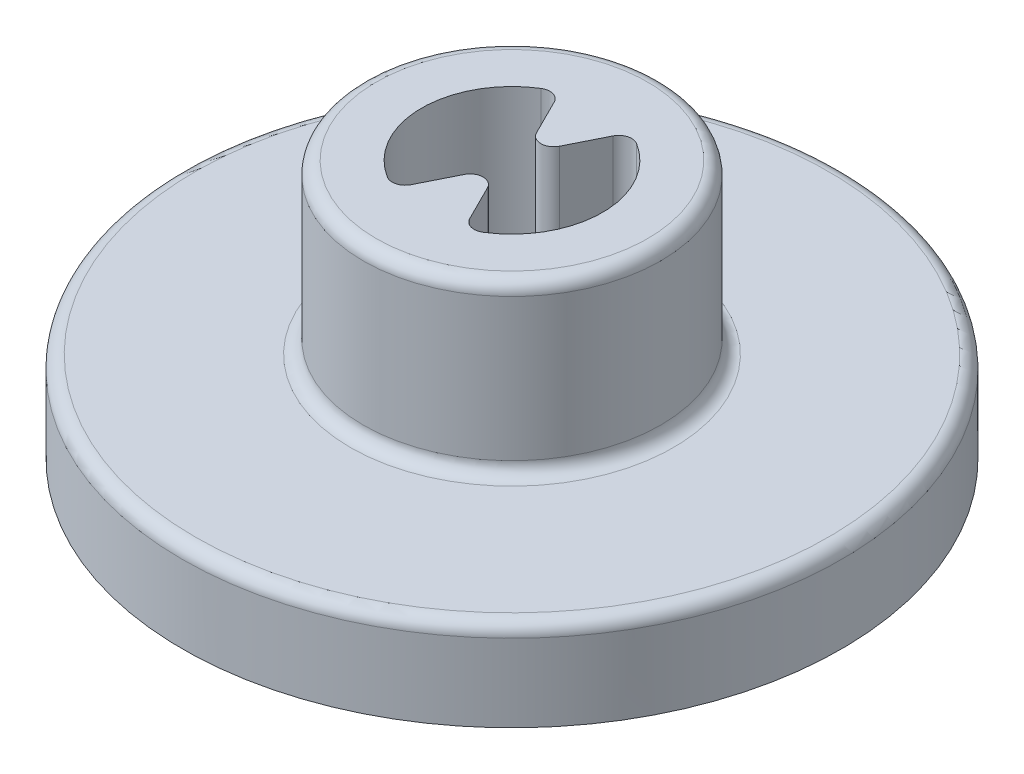
from build123d import *

# Parameters (mm, degrees)
SKETCH1_R           = 12.75
BOSS_EXTRUDE2_DEPTH = 3.5
SKETCH2_R           = 5.75
BOSS_EXTRUDE3_DEPTH = 6.5
CUT_EXTRUDE1_DEPTH  = 10
FILLET3_R           = 0.5
FILLET4_R           = 0.5


with BuildPart() as part:
    # Sketch1 → Boss-Extrude2 (new body)
    with BuildSketch(Plane(origin=(0, 0, 0), x_dir=(1, 0, 0), z_dir=(0, 1, 0))):
        with Locations(Location((0, 0, 0), (0, 0, 90))):
            Circle(SKETCH1_R)
    extrude(amount=BOSS_EXTRUDE2_DEPTH)

    # Sketch2 → Boss-Extrude3 (add)
    with BuildSketch(Plane(origin=(0, 3.5, 0), x_dir=(1, 0, 0), z_dir=(0, 1, 0))):
        with Locations(Location((0, 0, 0), (0, 0, 270))):
            Circle(SKETCH2_R)
    extrude(amount=BOSS_EXTRUDE3_DEPTH)

    # Sketch3 → Cut-Extrude1 (cut)
    with BuildSketch(Plane(origin=(0, 10, 0), x_dir=(1, 0, 0), z_dir=(0, 1, 0))):
        with BuildLine():
            Line((-0.447213595, 1.394427191), (-1.135934639, 2.771869278))
            ThreePointArc((-1.135934639, 2.771869278), (-1.447076632, 3.029390861), (-1.847006274, 2.972972894))
            ThreePointArc((-1.847006274, 2.972972894), (-3.5, 0), (-1.847006274, -2.972972894))
            ThreePointArc((-1.847006274, -2.972972894), (-1.447076632, -3.029390861), (-1.135934639, -2.771869278))
            Line((-1.135934639, -2.771869278), (-0.447213595, -1.394427191))
            ThreePointArc((-0.447213595, -1.394427191), (0, -1.118033989), (0.447213595, -1.394427191))
            Line((0.447213595, -1.394427191), (1.135934639, -2.771869278))
            ThreePointArc((1.135934639, -2.771869278), (1.447076632, -3.029390861), (1.847006274, -2.972972894))
            ThreePointArc((1.847006274, -2.972972894), (3.5, 0), (1.847006274, 2.972972894))
            ThreePointArc((1.847006274, 2.972972894), (1.447076632, 3.029390861), (1.135934639, 2.771869278))
            Line((1.135934639, 2.771869278), (0.447213595, 1.394427191))
            ThreePointArc((0.447213595, 1.394427191), (0, 1.118033989), (-0.447213595, 1.394427191))
        make_face()
    extrude(amount=-CUT_EXTRUDE1_DEPTH, mode=Mode.SUBTRACT)

    # Fillet3
    fillet3_edges = [part.edges().sort_by_distance(p)[0] for p in [
        (0, 3.5, 12.75),
        (0, 3.5, -5.75),
    ]]
    fillet(fillet3_edges, radius=FILLET3_R)

    # Fillet4
    fillet4_edges = [part.edges().sort_by_distance(p)[0] for p in [
        (0, 10, -5.75),
    ]]
    fillet(fillet4_edges, radius=FILLET4_R)


solid = part.part
